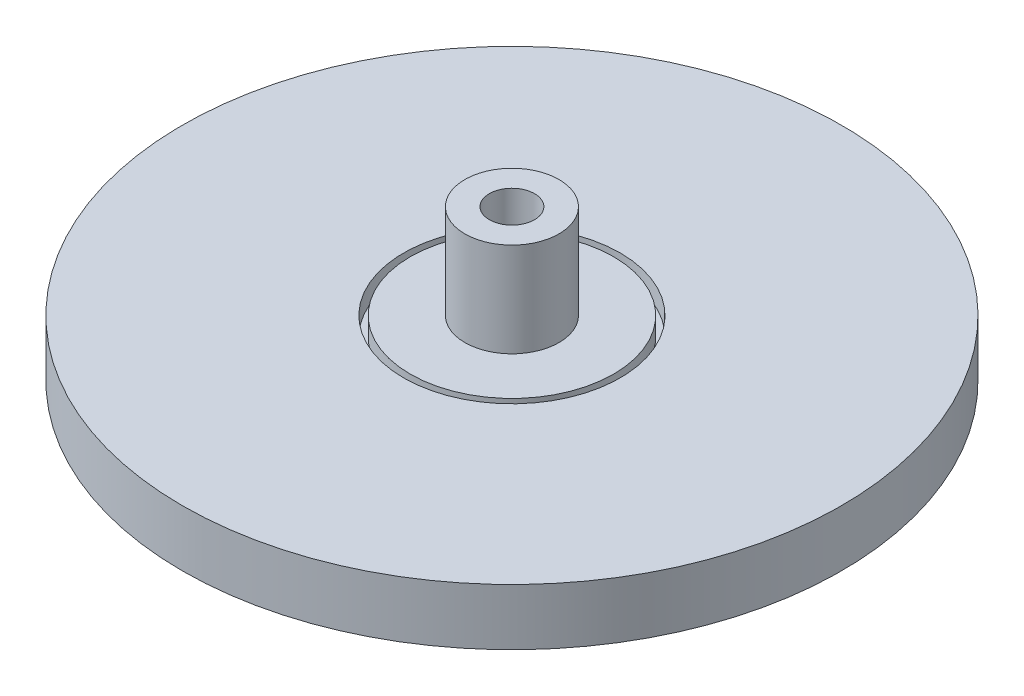
from build123d import *

# Parameters (mm, degrees)
SKETCH1_R           = 175
BOSS_EXTRUDE1_DEPTH = 30
SKETCH2_R           = 25
SKETCH2_R_2         = 12
BOSS_EXTRUDE2_DEPTH = 50
SKETCH3_R           = 57.5
SKETCH3_R_2         = 54
CUT_EXTRUDE1_DEPTH  = 10


with BuildPart() as part:
    # Sketch1 → Boss-Extrude1 (new body)
    with BuildSketch(Plane(origin=(0, 0, 0), x_dir=(1, 0, 0), z_dir=(0, 1, 0))):
        with Locations(Location((0, 0, 0), (0, 0, 270))):
            Circle(SKETCH1_R)
    extrude(amount=BOSS_EXTRUDE1_DEPTH)

    # Sketch2 → Boss-Extrude2 (add)
    with BuildSketch(Plane(origin=(0, 30, 0), x_dir=(1, 0, 0), z_dir=(0, 1, 0))):
        with Locations(Location((0, 0, 0), (0, 0, 270))):
            Circle(SKETCH2_R)
        with Locations(Location((0, 0, 0), (0, 0, 270))):
            Circle(SKETCH2_R_2, mode=Mode.SUBTRACT)
    extrude(amount=BOSS_EXTRUDE2_DEPTH)

    # Sketch3 → Cut-Extrude1 (cut)
    with BuildSketch(Plane(origin=(0, 30, 0), x_dir=(1, 0, 0), z_dir=(0, 1, 0))):
        with Locations(Location((0, 0, 0), (0, 0, 270))):
            Circle(SKETCH3_R)
        with Locations(Location((0, 0, 0), (0, 0, 270))):
            Circle(SKETCH3_R_2, mode=Mode.SUBTRACT)
    extrude(amount=-CUT_EXTRUDE1_DEPTH, mode=Mode.SUBTRACT)


solid = part.part
